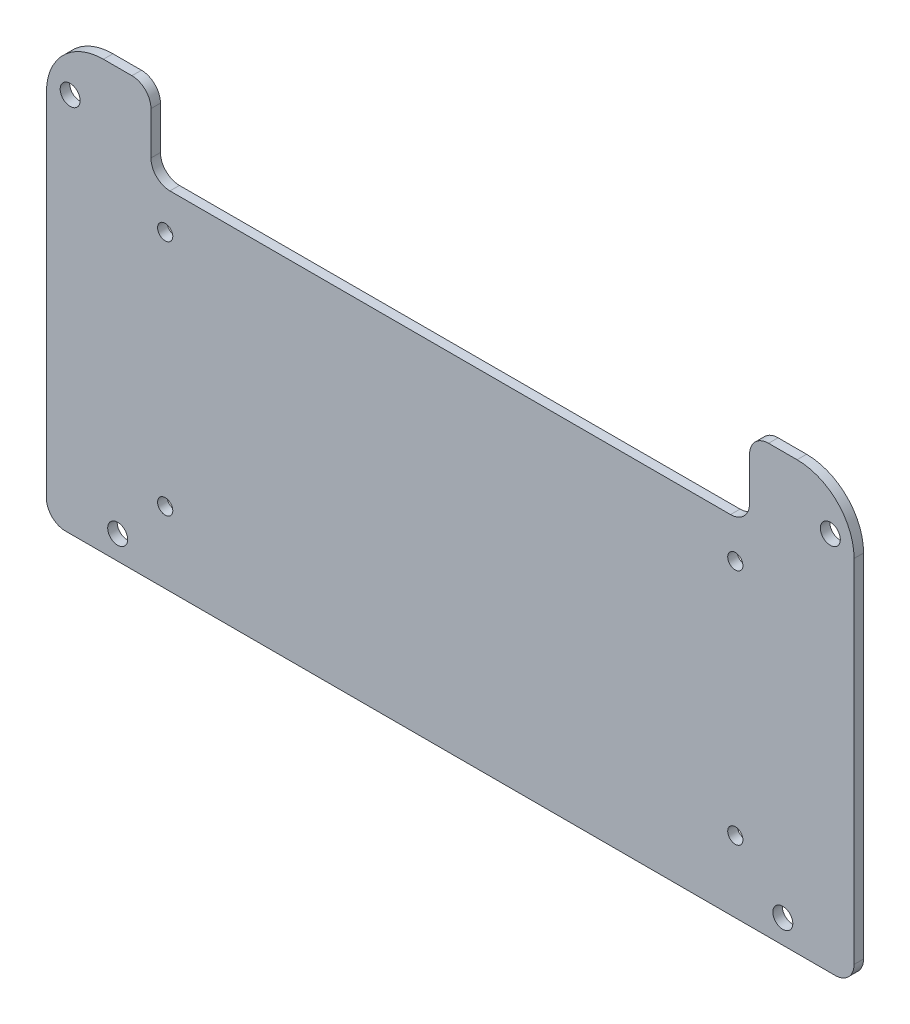
from build123d import *

# Parameters (mm, degrees)
SKETCH_1_W          = 170
SKETCH_1_H          = 90
EXTRUDE_1_DEPTH     = 2
SKETCH_4_R          = 2.1
CUT_EXTRUDE_5_DEPTH = 10
FILLET_1_R          = 4
CUT_EXTRUDE_6_DEPTH = 112.748746927
SKETCH_7_R          = 1.6
CUT_EXTRUDE_7_DEPTH = 112.748746927
FILLET_2_R          = 4
FILLET_3_R          = 12


with BuildPart() as part:
    # 草图1 → 凸台-拉伸1 (new body)
    with BuildSketch(Plane.XY):
        with Locations((-10.625, 12.789634146)):
            Rectangle(SKETCH_1_W, SKETCH_1_H)
    extrude(amount=EXTRUDE_1_DEPTH)

    # 草图4 → 切除-拉伸5 (cut)
    with BuildSketch(Plane.XY.offset(2)):
        with Locations((59.375, -27.210365854)):
            Circle(SKETCH_4_R)
        with Locations((-80.625, -27.210365854)):
            Circle(SKETCH_4_R)
        with Locations((69.375, 47.789634146)):
            Circle(SKETCH_4_R)
        with Locations((-90.625, 47.789634146)):
            Circle(SKETCH_4_R)
    extrude(amount=-CUT_EXTRUDE_5_DEPTH, mode=Mode.SUBTRACT)

    # 圆角1
    fillet_1_edges = [part.edges().sort_by_distance(p)[0] for p in [
        (74.375, -32.210365854, 1),
        (-95.625, -32.210365854, 1),
    ]]
    fillet(fillet_1_edges, radius=FILLET_1_R)

    # 草图5 → 切除-拉伸6 (cut, through all)
    with BuildSketch(Plane.XY.offset(2)):
        Polygon((-73.625, 40.789634146), (52.375, 40.789634146), (52.375, 47.789634146), (52.375, 57.789634146), (2.375, 57.789634146), (-4.625, 57.789634146), (-73.625, 57.789634146), align=None)
    extrude(amount=-CUT_EXTRUDE_6_DEPTH, mode=Mode.SUBTRACT)

    # 草图7 → 切除-拉伸7 (cut, through all)
    with BuildSketch(Plane.XY.offset(2)):
        with Locations((49.375, 32.789634146)):
            Circle(SKETCH_7_R)
        with Locations((49.375, -17.210365854)):
            Circle(SKETCH_7_R)
        with Locations(Location((-70.625, -17.210365854, 0), (0, 0, 180))):
            Circle(SKETCH_7_R)
        with Locations(Location((-70.625, 32.789634146, 0), (0, 0, 180))):
            Circle(SKETCH_7_R)
    extrude(amount=-CUT_EXTRUDE_7_DEPTH, mode=Mode.SUBTRACT)

    # 圆角2
    fillet_2_edges = [part.edges().sort_by_distance(p)[0] for p in [
        (52.375, 40.789634146, 1),
        (-73.625, 40.789634146, 1),
        (-73.625, 57.789634146, 1),
        (52.375, 57.789634146, 1),
    ]]
    fillet(fillet_2_edges, radius=FILLET_2_R)

    # 圆角3
    fillet_3_edges = [part.edges().sort_by_distance(p)[0] for p in [
        (-95.625, 57.789634146, 1),
        (74.375, 57.789634146, 1),
    ]]
    fillet(fillet_3_edges, radius=FILLET_3_R)


solid = part.part
